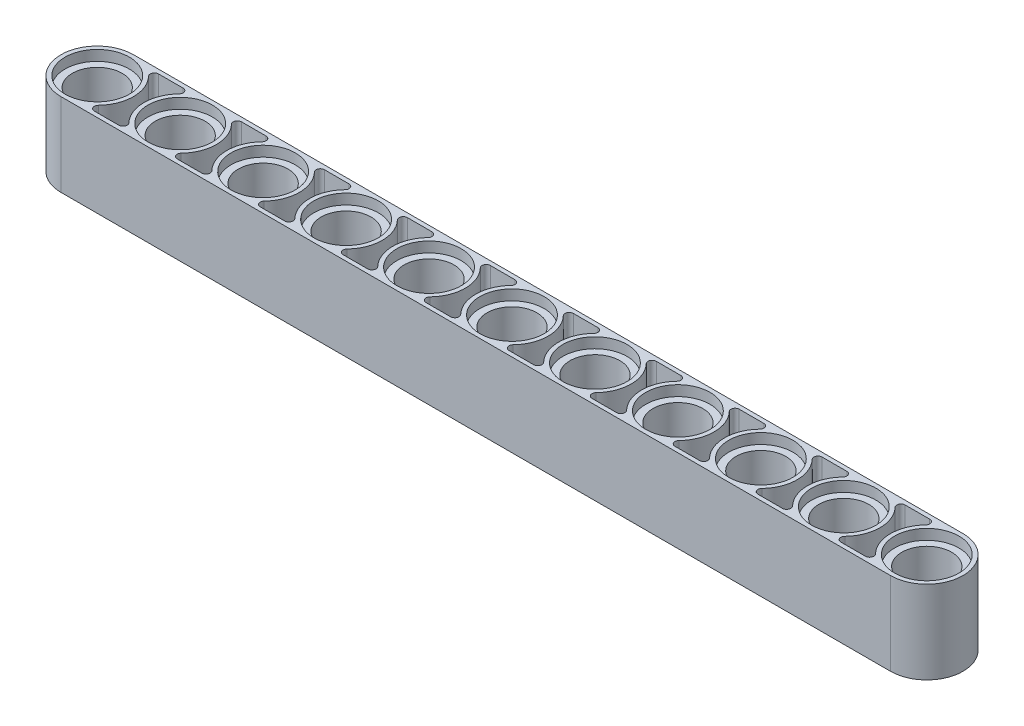
from build123d import *

# Parameters (mm, degrees)
BOSS_EXTRUDE1_DEPTH = 4
SKETCH2_R           = 3.1
CUT_EXTRUDE1_DEPTH  = 1
CUT_EXTRUDE2_START  = -1
SKETCH3_R           = 3.1
CUT_EXTRUDE2_DEPTH  = 1
SKETCH4_R           = 2.4
CUT_EXTRUDE3_DEPTH  = 84.668990672
LPATTERN1_COUNT     = 11
LPATTERN1_PITCH     = 8
CUT_EXTRUDE4_DEPTH  = 84.668990672
LPATTERN2_COUNT     = 10
LPATTERN2_PITCH     = 8


with BuildPart() as part:
    # Sketch1 → Boss-Extrude1 (new, symmetric)
    with BuildSketch(Plane(origin=(0, 0, 0), x_dir=(1, 0, 0), z_dir=(0, 1, 0))):
        with BuildLine():
            Line((0, 3.5), (80, 3.5))
            ThreePointArc((80, 3.5), (83.5, 0), (80, -3.5))
            Line((80, -3.5), (0, -3.5))
            ThreePointArc((0, -3.5), (-3.5, 0), (0, 3.5))
        make_face()
    extrude(amount=BOSS_EXTRUDE1_DEPTH, both=True)

    # Sketch2 → Cut-Extrude1 (cut)
    with BuildSketch(Plane(origin=(0, 4, 0), x_dir=(1, 0, 0), z_dir=(0, 1, 0))):
        with Locations(Location((0, 0, 0), (0, 0, 270))):
            Circle(SKETCH2_R)
    cut_extrude1 = extrude(amount=-CUT_EXTRUDE1_DEPTH, mode=Mode.SUBTRACT)

    # Sketch3 → Cut-Extrude2 (cut)
    with BuildSketch(Plane(origin=(0, -4, 0), x_dir=(-1, 0, 0), z_dir=(0, -1, 0)).offset(CUT_EXTRUDE2_START)):
        with Locations(Location((0, 0, 0), (0, 0, 270))):
            Circle(SKETCH3_R)
    cut_extrude2 = extrude(amount=CUT_EXTRUDE2_DEPTH, mode=Mode.SUBTRACT)

    # Sketch4 → Cut-Extrude3 (cut, symmetric)
    with BuildSketch(Plane(origin=(0, 0, 0), x_dir=(1, 0, 0), z_dir=(0, 1, 0))):
        with Locations(Location((0, 0, 0), (0, 0, 270))):
            Circle(SKETCH4_R)
    cut_extrude3 = extrude(amount=CUT_EXTRUDE3_DEPTH, both=True, mode=Mode.SUBTRACT)

    # LPattern1: Cut-Extrude1, Cut-Extrude2, Cut-Extrude3 ×11
    with Locations(*[(i * LPATTERN1_PITCH, 0, 0) for i in range(1, LPATTERN1_COUNT)]):
        add(cut_extrude1, mode=Mode.SUBTRACT)
        add(cut_extrude2, mode=Mode.SUBTRACT)
        add(cut_extrude3, mode=Mode.SUBTRACT)

    # Sketch5 → Cut-Extrude4 (cut, symmetric)
    with BuildSketch(Plane(origin=(0, 0, 0), x_dir=(1, 0, 0), z_dir=(0, 1, 0))):
        with BuildLine():
            Line((2.814249456, 3.1), (5.185750544, 3.1))
            ThreePointArc((5.185750544, 3.1), (5.553697029, 2.856892908), (5.474391514, 2.423076923))
            ThreePointArc((5.474391514, 2.423076923), (4.5, 0), (5.474391514, -2.423076923))
            ThreePointArc((5.474391514, -2.423076923), (5.553697029, -2.856892908), (5.185750544, -3.1))
            Line((5.185750544, -3.1), (2.814249456, -3.1))
            ThreePointArc((2.814249456, -3.1), (2.446302971, -2.856892908), (2.525608486, -2.423076923))
            ThreePointArc((2.525608486, -2.423076923), (3.5, 0), (2.525608486, 2.423076923))
            ThreePointArc((2.525608486, 2.423076923), (2.446302971, 2.856892908), (2.814249456, 3.1))
        make_face()
    cut_extrude4 = extrude(amount=CUT_EXTRUDE4_DEPTH, both=True, mode=Mode.SUBTRACT)

    # LPattern2: Cut-Extrude4 ×10
    with Locations(*[(i * LPATTERN2_PITCH, 0, 0) for i in range(1, LPATTERN2_COUNT)]):
        add(cut_extrude4, mode=Mode.SUBTRACT)


solid = part.part
